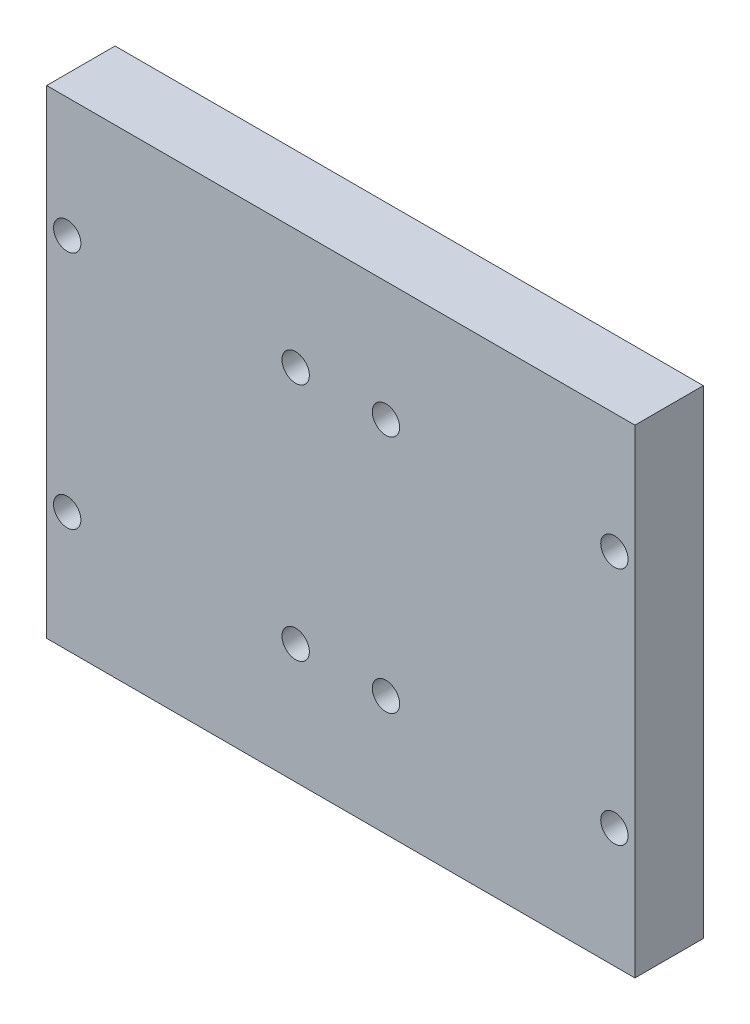
from build123d import *

# Parameters (mm, degrees)
ESQUISSE1_W        = 86
ESQUISSE1_H        = 70
ESQUISSE1_R        = 2
BOSS_EXTRU_1_DEPTH = 10


with BuildPart() as part:
    # Esquisse1 → Boss.-Extru.1 (new body)
    with BuildSketch(Plane.XY):
        with Locations((43, -35)):
            Rectangle(ESQUISSE1_W, ESQUISSE1_H)
        with Locations((3, -17.5)):
            Circle(ESQUISSE1_R, mode=Mode.SUBTRACT)
        with Locations((3, -52.5)):
            Circle(ESQUISSE1_R, mode=Mode.SUBTRACT)
        with Locations((36.4, -52.5)):
            Circle(ESQUISSE1_R, mode=Mode.SUBTRACT)
        with Locations((36.4, -17.5)):
            Circle(ESQUISSE1_R, mode=Mode.SUBTRACT)
        with Locations(Location((49.6, -52.5, 0), (0, 0, 180))):
            Circle(ESQUISSE1_R, mode=Mode.SUBTRACT)
        with Locations(Location((83, -52.5, 0), (0, 0, 180))):
            Circle(ESQUISSE1_R, mode=Mode.SUBTRACT)
        with Locations(Location((83, -17.5, 0), (0, 0, 180))):
            Circle(ESQUISSE1_R, mode=Mode.SUBTRACT)
        with Locations(Location((49.6, -17.5, 0), (0, 0, 180))):
            Circle(ESQUISSE1_R, mode=Mode.SUBTRACT)
    extrude(amount=BOSS_EXTRU_1_DEPTH)


solid = part.part
